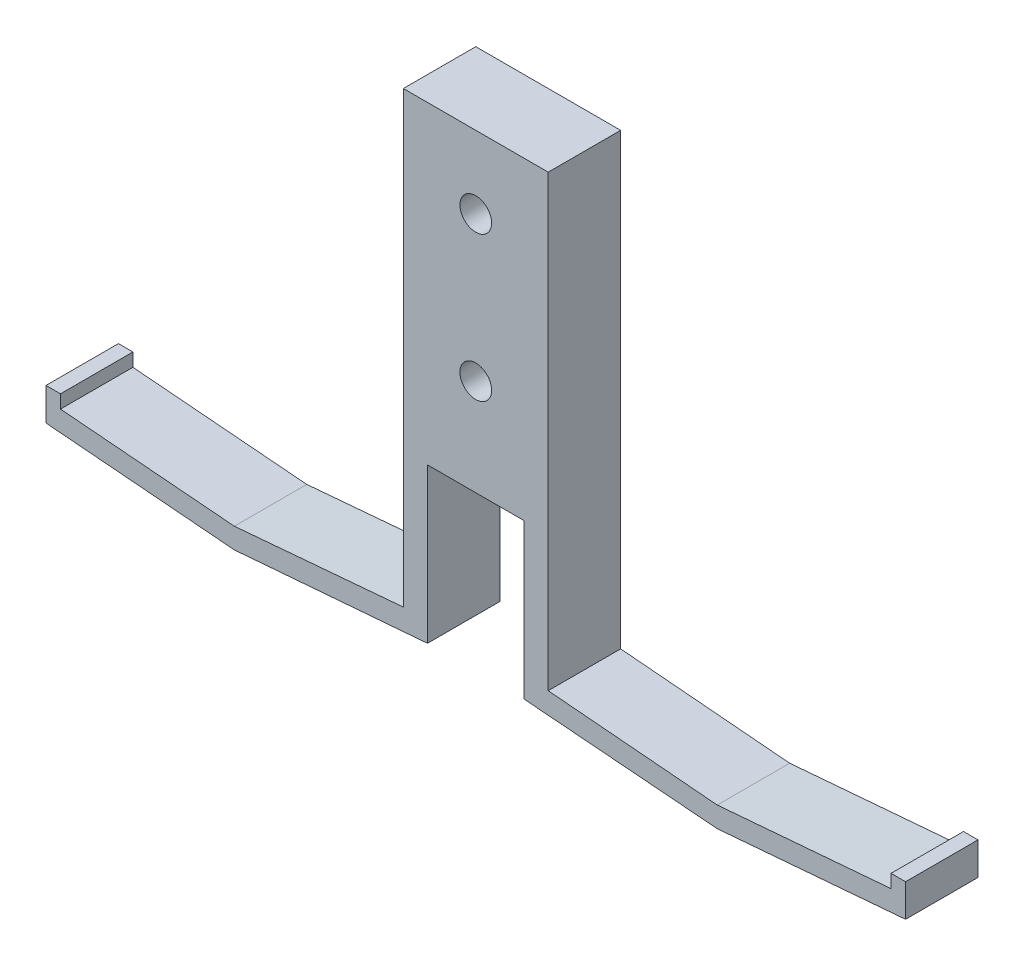
from build123d import *

# Parameters (mm, degrees)
BOSS_EXTRUDE1_DEPTH              = 19.05
F_21_64_0_32813_DIAMETER_HOLE1_D = 8.334502


with BuildPart() as part:
    # Sketch2 → Boss-Extrude1 (new body)
    with BuildSketch(Plane.XY):
        Polygon((0, 0), (12.7, 0), (12.7, -40.64), (63.5, -44.7675), (113.03, -40.64), (113.03, -32.0675), (109.22, -32.0675), (109.22, -35.56), (63.5, -39.37), (19.05, -35.56), (19.05, 0), (19.05, 82.55), (0, 82.55), align=None)
        Polygon((-12.7, 0), (0, 0), (0, 82.55), (-19.05, 82.55), (-19.05, 0), (-19.05, -35.56), (-63.5, -39.37), (-109.22, -35.56), (-109.22, -32.0675), (-113.03, -32.0675), (-113.03, -40.64), (-63.5, -44.7675), (-12.7, -40.64), align=None)
    extrude(amount=BOSS_EXTRUDE1_DEPTH)

    # 21/64 (0.32813) Diameter Hole1 (through all)
    with Locations(Plane.XY.offset(19.05)):
        with Locations((0, 25.4), (0, 63.5)):
            Hole(F_21_64_0_32813_DIAMETER_HOLE1_D / 2)


solid = part.part
